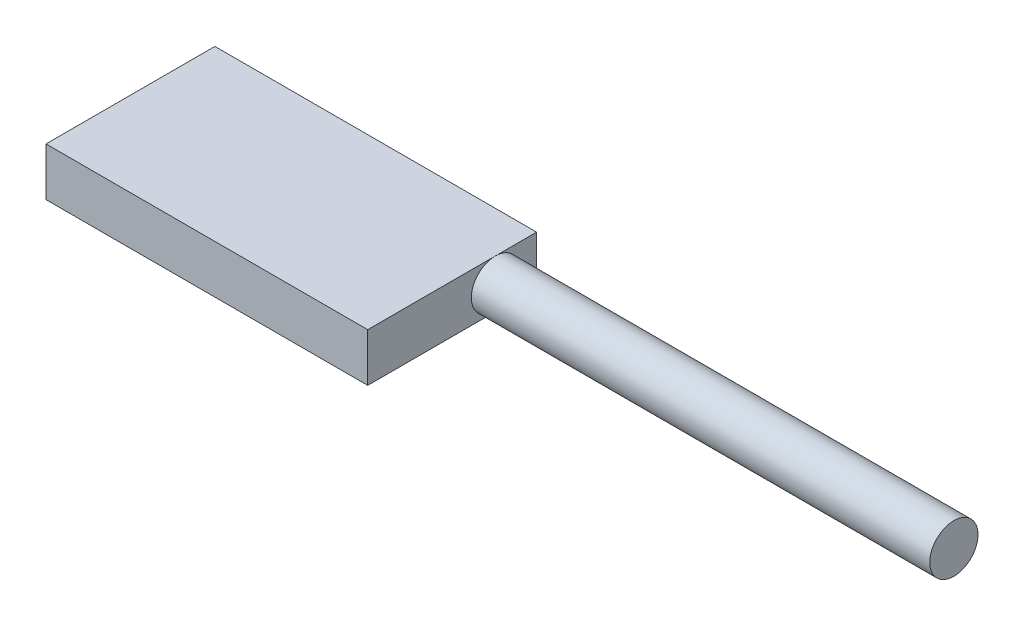
from build123d import *

# Parameters (mm, degrees)
SKETCH1_W           = 40
SKETCH1_H           = 21
BOSS_EXTRUDE1_DEPTH = 6
SKETCH3_R           = 3
BOSS_EXTRUDE2_DEPTH = 57


with BuildPart() as part:
    # Sketch1 → Boss-Extrude1 (new body)
    with BuildSketch(Plane(origin=(0, 0, 0), x_dir=(1, 0, 0), z_dir=(0, 1, 0))):
        Rectangle(SKETCH1_W, SKETCH1_H)
    extrude(amount=BOSS_EXTRUDE1_DEPTH)

    # Sketch3 → Boss-Extrude2 (add)
    with BuildSketch(Plane(origin=(20, 0, 0), x_dir=(0, 0, -1), z_dir=(1, 0, 0))):
        with Locations(Location((5.379889209, 3, 0), (0, 0, 270))):
            Circle(SKETCH3_R)
    extrude(amount=BOSS_EXTRUDE2_DEPTH)


solid = part.part
